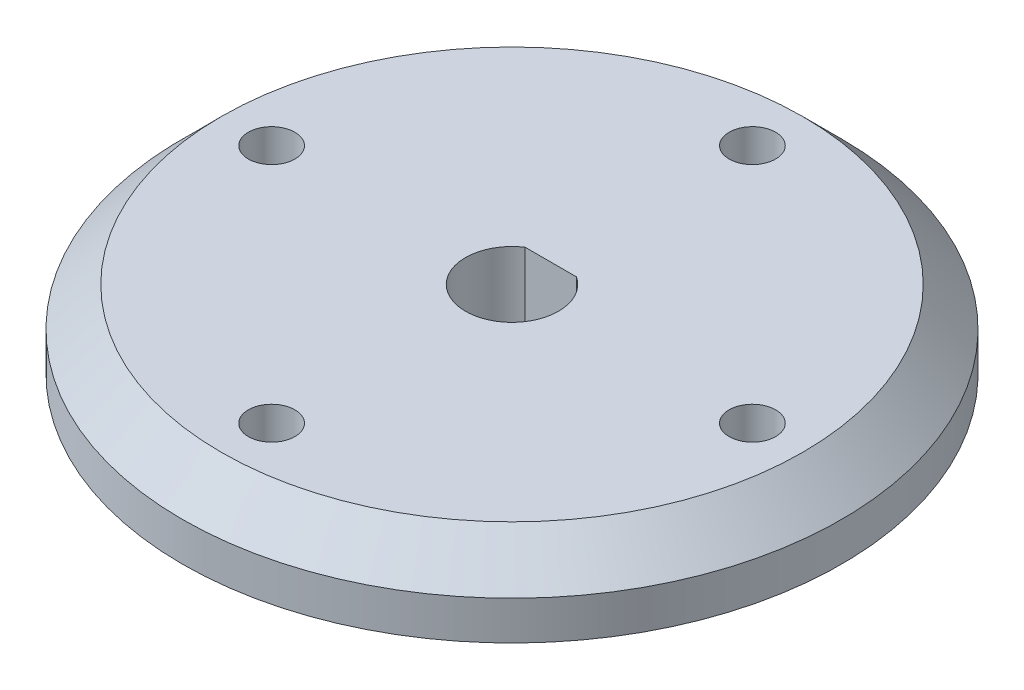
from build123d import *

# Parameters (mm, degrees)
SKETCH1_R           = 21.25
SKETCH1_R_2         = 1.5
BOSS_EXTRUDE1_DEPTH = 5
CHAMFER1_SIZE       = 2.5


with BuildPart() as part:
    # Sketch1 → Boss-Extrude1 (new body)
    with BuildSketch(Plane(origin=(0, 0, 0), x_dir=(1, 0, 0), z_dir=(0, 1, 0))):
        with Locations(Location((0, 0, 0), (0, 0, 270))):
            Circle(SKETCH1_R)
        with Locations(Location((0, 15.5, 0), (0, 0, 270))):
            Circle(SKETCH1_R_2, mode=Mode.SUBTRACT)
        with Locations(Location((15.5, 0, 0), (0, 0, 270))):
            Circle(SKETCH1_R_2, mode=Mode.SUBTRACT)
        with Locations(Location((0, -15.5, 0), (0, 0, 270))):
            Circle(SKETCH1_R_2, mode=Mode.SUBTRACT)
        with Locations(Location((-15.5, 0, 0), (0, 0, 270))):
            Circle(SKETCH1_R_2, mode=Mode.SUBTRACT)
        with BuildLine():
            Line((-1.658312395, 2.5), (1.658312395, 2.5))
            ThreePointArc((1.658312395, 2.5), (0, -3), (-1.658312395, 2.5))
        make_face(mode=Mode.SUBTRACT)
    extrude(amount=BOSS_EXTRUDE1_DEPTH)

    # Chamfer1
    chamfer1_edges = [part.edges().sort_by_distance(p)[0] for p in [
        (0, 5, -21.25),
    ]]
    chamfer(chamfer1_edges, length=CHAMFER1_SIZE)


solid = part.part
